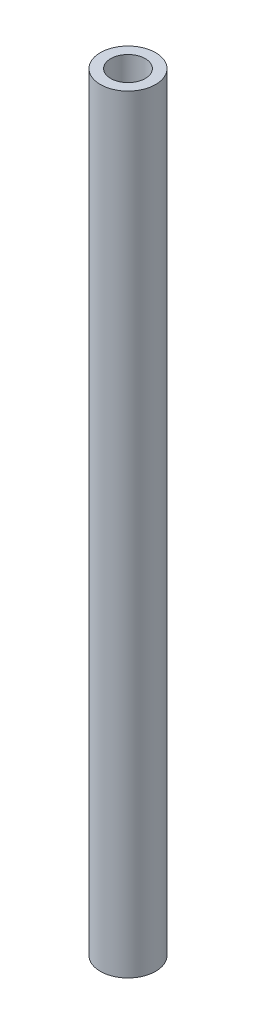
from build123d import *

# Parameters (mm, degrees)
SKETCH1_R           = 1
BOSS_EXTRUDE1_DEPTH = 27.8


with BuildPart() as part:
    # Sketch1 → Boss-Extrude1 (new body)
    with BuildSketch(Plane(origin=(0, 0, 0), x_dir=(1, 0, 0), z_dir=(0, 1, 0))):
        with Locations(Location((0, 0, 0), (0, 0, 270))):
            Circle(SKETCH1_R)
    extrude(amount=BOSS_EXTRUDE1_DEPTH)

    # Sketch4 → M1.6x0.35 Tapped Hole1 (revolve, cut)
    with BuildSketch(Plane(origin=(0, 27.8, 0), x_dir=(0, 0, 1), z_dir=(1, 0, 0))):
        Polygon((0, 0), (0, 6.375537887), (0.625, 6), (0.625, 0), align=None)
    m1_6x0_35_tapped_hole1 = revolve(axis=Axis((0, 34.15, 0), (0, -1, 0)), mode=Mode.SUBTRACT)

    # Mirror1: M1.6x0.35 Tapped Hole1 across plane
    add(m1_6x0_35_tapped_hole1.mirror(Plane(origin=(0, 13.9, 0), x_dir=(0, 0, 1), z_dir=(0, -1, 0))), mode=Mode.SUBTRACT)


solid = part.part
